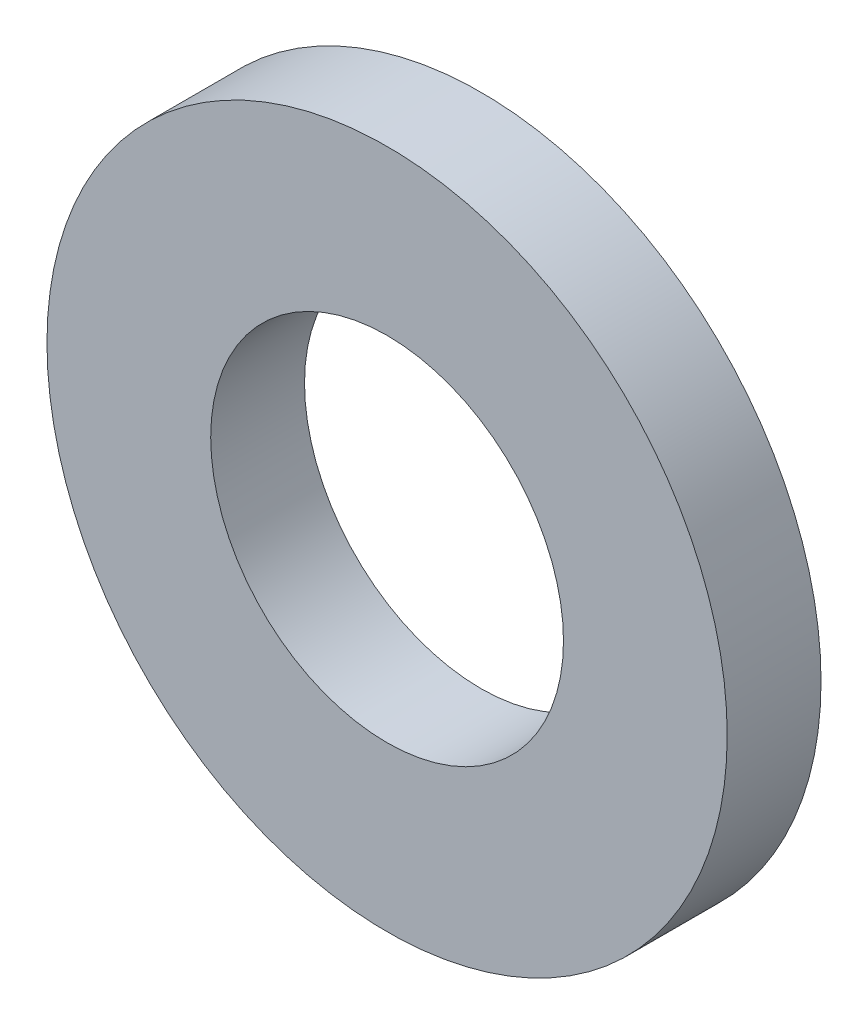
from build123d import *

# Parameters (mm, degrees)
SKETCH1_W = 12.7
SKETCH1_H = 22.1615


with BuildPart() as part:
    # Sketch1 → Revolve1 (revolve)
    with BuildSketch(Plane(origin=(0, 0, 0), x_dir=(0, 0, -1), z_dir=(1, 0, 0)), mode=Mode.PRIVATE) as revolve1_sk:
        with Locations((6.35, 34.95675)):
            Rectangle(SKETCH1_W, SKETCH1_H)
    revolve(revolve1_sk.sketch.rotate(Axis((0, 0, 0), (0, 0, -1)), 90), axis=Axis((0, 0, 0), (0, 0, -1)))


solid = part.part
